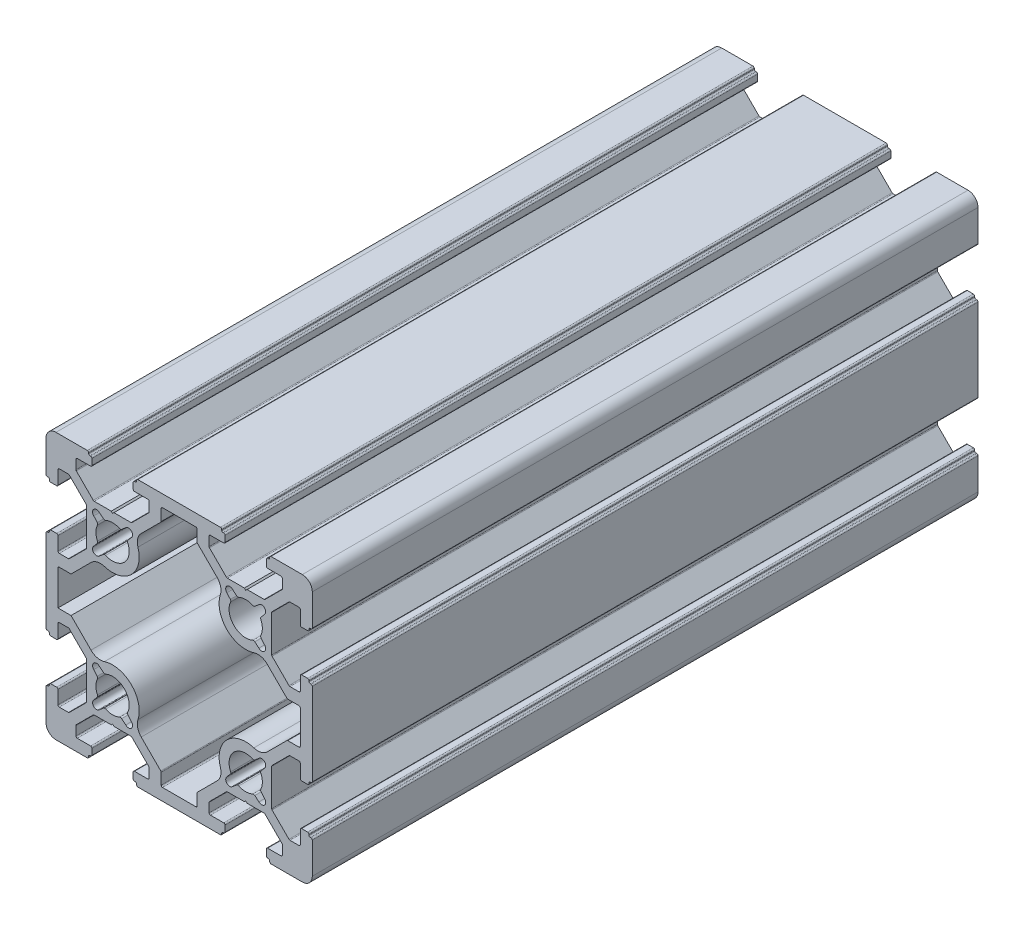
from build123d import *

# Parameters (mm, degrees)
EXTRUDE_1_DEPTH = 100


with BuildPart() as part:
    # 草图1 → 凸台-拉伸1 (new body)
    with BuildSketch(Plane.XY):
        with BuildLine():
            Line((42.461191718, 11.6), (43.361191718, 11.6))
            ThreePointArc((43.361191718, 11.6), (43.502613074, 11.658578644), (43.561191718, 11.8))
            Line((43.561191718, 11.8), (43.561191718, 11.9))
            ThreePointArc((43.561191718, 11.9), (43.619770361, 12.041421356), (43.761191718, 12.1))
            Line((43.761191718, 12.1), (43.861191718, 12.1))
            ThreePointArc((43.861191718, 12.1), (44.002613074, 12.158578644), (44.061191718, 12.3))
            Line((44.061191718, 12.3), (44.061191718, 24.7))
            ThreePointArc((44.061191718, 24.7), (44.002613074, 24.841421356), (43.861191718, 24.9))
            Line((43.861191718, 24.9), (43.761191718, 24.9))
            ThreePointArc((43.761191718, 24.9), (43.619770361, 24.958578644), (43.561191718, 25.1))
            Line((43.561191718, 25.1), (43.561191718, 25.2))
            ThreePointArc((43.561191718, 25.2), (43.502613074, 25.341421356), (43.361191718, 25.4))
            Line((43.361191718, 25.4), (42.461191718, 25.4))
            ThreePointArc((42.461191718, 25.4), (42.319770361, 25.341421356), (42.261191718, 25.2))
            Line((42.261191718, 25.2), (42.261191718, 23.2))
            ThreePointArc((42.261191718, 23.2), (42.202613074, 23.058578644), (42.061191718, 23))
            Line((42.061191718, 23), (40.704694602, 23))
            ThreePointArc((40.704694602, 23), (40.628157916, 23.015224093), (40.563273246, 23.058578644))
            Line((40.563273246, 23.058578644), (38.019770361, 25.602081528))
            ThreePointArc((38.019770361, 25.602081528), (37.976415811, 25.666966198), (37.961191718, 25.743502884))
            Line((37.961191718, 25.743502884), (37.961191718, 31.256497116))
            ThreePointArc((37.961191718, 31.256497116), (37.976415811, 31.333033802), (38.019770361, 31.397918472))
            Line((38.019770361, 31.397918472), (40.563273246, 33.941421356))
            ThreePointArc((40.563273246, 33.941421356), (40.628157916, 33.984775907), (40.704694602, 34))
            Line((40.704694602, 34), (42.061191718, 34))
            ThreePointArc((42.061191718, 34), (42.202613074, 33.941421356), (42.261191718, 33.8))
            Line((42.261191718, 33.8), (42.261191718, 31.8))
            ThreePointArc((42.261191718, 31.8), (42.319770361, 31.658578644), (42.461191718, 31.6))
            Line((42.461191718, 31.6), (43.361191718, 31.6))
            ThreePointArc((43.361191718, 31.6), (43.502613074, 31.658578644), (43.561191718, 31.8))
            Line((43.561191718, 31.8), (43.561191718, 31.9))
            ThreePointArc((43.561191718, 31.9), (43.619770361, 32.041421356), (43.761191718, 32.1))
            Line((43.761191718, 32.1), (43.861191718, 32.1))
            ThreePointArc((43.861191718, 32.1), (44.002613074, 32.158578644), (44.061191718, 32.3))
            Line((44.061191718, 32.3), (44.061191718, 37))
            ThreePointArc((44.061191718, 37), (43.62185189, 38.060660172), (42.561191718, 38.5))
            Line((42.561191718, 38.5), (37.861191718, 38.5))
            ThreePointArc((37.861191718, 38.5), (37.719770361, 38.441421356), (37.661191718, 38.3))
            Line((37.661191718, 38.3), (37.661191718, 38.2))
            ThreePointArc((37.661191718, 38.2), (37.602613074, 38.058578644), (37.461191718, 38))
            Line((37.461191718, 38), (37.361191718, 38))
            ThreePointArc((37.361191718, 38), (37.219770361, 37.941421356), (37.161191718, 37.8))
            Line((37.161191718, 37.8), (37.161191718, 36.9))
            ThreePointArc((37.161191718, 36.9), (37.219770361, 36.758578644), (37.361191718, 36.7))
            Line((37.361191718, 36.7), (39.361191718, 36.7))
            ThreePointArc((39.361191718, 36.7), (39.502613074, 36.641421356), (39.561191718, 36.5))
            Line((39.561191718, 36.5), (39.561191718, 35.143502884))
            ThreePointArc((39.561191718, 35.143502884), (39.545967624, 35.066966198), (39.502613074, 35.002081528))
            Line((39.502613074, 35.002081528), (36.95911019, 32.458578644))
            ThreePointArc((36.95911019, 32.458578644), (36.89422552, 32.415224093), (36.817688833, 32.4))
            Line((36.817688833, 32.4), (34.261191718, 32.4))
            Line((34.261191718, 32.4), (34.061191718, 32.2))
            Line((34.061191718, 32.2), (33.861191718, 32.4))
            Line((33.861191718, 32.4), (31.304694602, 32.4))
            ThreePointArc((31.304694602, 32.4), (31.228157916, 32.415224093), (31.163273246, 32.458578644))
            Line((31.163273246, 32.458578644), (28.619770361, 35.002081528))
            ThreePointArc((28.619770361, 35.002081528), (28.576415811, 35.066966198), (28.561191718, 35.143502884))
            Line((28.561191718, 35.143502884), (28.561191718, 36.5))
            ThreePointArc((28.561191718, 36.5), (28.619770361, 36.641421356), (28.761191718, 36.7))
            Line((28.761191718, 36.7), (30.761191718, 36.7))
            ThreePointArc((30.761191718, 36.7), (30.902613074, 36.758578644), (30.961191718, 36.9))
            Line((30.961191718, 36.9), (30.961191718, 37.8))
            ThreePointArc((30.961191718, 37.8), (30.902613074, 37.941421356), (30.761191718, 38))
            Line((30.761191718, 38), (30.661191718, 38))
            ThreePointArc((30.661191718, 38), (30.519770361, 38.058578644), (30.461191718, 38.2))
            Line((30.461191718, 38.2), (30.461191718, 38.3))
            ThreePointArc((30.461191718, 38.3), (30.402613074, 38.441421356), (30.261191718, 38.5))
            Line((30.261191718, 38.5), (17.861191718, 38.5))
            ThreePointArc((17.861191718, 38.5), (17.719770361, 38.441421356), (17.661191718, 38.3))
            Line((17.661191718, 38.3), (17.661191718, 38.2))
            ThreePointArc((17.661191718, 38.2), (17.602613074, 38.058578644), (17.461191718, 38))
            Line((17.461191718, 38), (17.361191718, 38))
            ThreePointArc((17.361191718, 38), (17.219770361, 37.941421356), (17.161191718, 37.8))
            Line((17.161191718, 37.8), (17.161191718, 36.9))
            ThreePointArc((17.161191718, 36.9), (17.219770361, 36.758578644), (17.361191718, 36.7))
            Line((17.361191718, 36.7), (19.361191718, 36.7))
            ThreePointArc((19.361191718, 36.7), (19.502613074, 36.641421356), (19.561191718, 36.5))
            Line((19.561191718, 36.5), (19.561191718, 35.143502884))
            ThreePointArc((19.561191718, 35.143502884), (19.545967624, 35.066966198), (19.502613074, 35.002081528))
            Line((19.502613074, 35.002081528), (16.95911019, 32.458578644))
            ThreePointArc((16.95911019, 32.458578644), (16.89422552, 32.415224093), (16.817688833, 32.4))
            Line((16.817688833, 32.4), (14.261191718, 32.4))
            Line((14.261191718, 32.4), (14.061191718, 32.2))
            Line((14.061191718, 32.2), (13.861191718, 32.4))
            Line((13.861191718, 32.4), (11.304694602, 32.4))
            ThreePointArc((11.304694602, 32.4), (11.228157916, 32.415224093), (11.163273246, 32.458578644))
            Line((11.163273246, 32.458578644), (8.619770361, 35.002081528))
            ThreePointArc((8.619770361, 35.002081528), (8.576415811, 35.066966198), (8.561191718, 35.143502884))
            Line((8.561191718, 35.143502884), (8.561191718, 36.5))
            ThreePointArc((8.561191718, 36.5), (8.619770361, 36.641421356), (8.761191718, 36.7))
            Line((8.761191718, 36.7), (10.761191718, 36.7))
            ThreePointArc((10.761191718, 36.7), (10.902613074, 36.758578644), (10.961191718, 36.9))
            Line((10.961191718, 36.9), (10.961191718, 37.8))
            ThreePointArc((10.961191718, 37.8), (10.902613074, 37.941421356), (10.761191718, 38))
            Line((10.761191718, 38), (10.661191718, 38))
            ThreePointArc((10.661191718, 38), (10.519770361, 38.058578644), (10.461191718, 38.2))
            Line((10.461191718, 38.2), (10.461191718, 38.3))
            ThreePointArc((10.461191718, 38.3), (10.402613074, 38.441421356), (10.261191718, 38.5))
            Line((10.261191718, 38.5), (5.561191718, 38.5))
            ThreePointArc((5.561191718, 38.5), (4.500531546, 38.060660172), (4.061191718, 37))
            Line((4.061191718, 37), (4.061191718, 32.3))
            ThreePointArc((4.061191718, 32.3), (4.119770361, 32.158578644), (4.261191718, 32.1))
            Line((4.261191718, 32.1), (4.361191718, 32.1))
            ThreePointArc((4.361191718, 32.1), (4.502613074, 32.041421356), (4.561191718, 31.9))
            Line((4.561191718, 31.9), (4.561191718, 31.8))
            ThreePointArc((4.561191718, 31.8), (4.619770361, 31.658578644), (4.761191718, 31.6))
            Line((4.761191718, 31.6), (5.661191718, 31.6))
            ThreePointArc((5.661191718, 31.6), (5.802613074, 31.658578644), (5.861191718, 31.8))
            Line((5.861191718, 31.8), (5.861191718, 33.8))
            ThreePointArc((5.861191718, 33.8), (5.919770361, 33.941421356), (6.061191718, 34))
            Line((6.061191718, 34), (7.417688833, 34))
            ThreePointArc((7.417688833, 34), (7.49422552, 33.984775907), (7.55911019, 33.941421356))
            Line((7.55911019, 33.941421356), (10.102613074, 31.397918472))
            ThreePointArc((10.102613074, 31.397918472), (10.145967624, 31.333033802), (10.161191718, 31.256497116))
            Line((10.161191718, 31.256497116), (10.161191718, 25.743502884))
            ThreePointArc((10.161191718, 25.743502884), (10.145967624, 25.666966198), (10.102613074, 25.602081528))
            Line((10.102613074, 25.602081528), (7.55911019, 23.058578644))
            ThreePointArc((7.55911019, 23.058578644), (7.49422552, 23.015224093), (7.417688833, 23))
            Line((7.417688833, 23), (6.061191718, 23))
            ThreePointArc((6.061191718, 23), (5.919770361, 23.058578644), (5.861191718, 23.2))
            Line((5.861191718, 23.2), (5.861191718, 25.2))
            ThreePointArc((5.861191718, 25.2), (5.802613074, 25.341421356), (5.661191718, 25.4))
            Line((5.661191718, 25.4), (4.761191718, 25.4))
            ThreePointArc((4.761191718, 25.4), (4.619770361, 25.341421356), (4.561191718, 25.2))
            Line((4.561191718, 25.2), (4.561191718, 25.1))
            ThreePointArc((4.561191718, 25.1), (4.502613074, 24.958578644), (4.361191718, 24.9))
            Line((4.361191718, 24.9), (4.261191718, 24.9))
            ThreePointArc((4.261191718, 24.9), (4.119770361, 24.841421356), (4.061191718, 24.7))
            Line((4.061191718, 24.7), (4.061191718, 12.3))
            ThreePointArc((4.061191718, 12.3), (4.119770361, 12.158578644), (4.261191718, 12.1))
            Line((4.261191718, 12.1), (4.361191718, 12.1))
            ThreePointArc((4.361191718, 12.1), (4.502613074, 12.041421356), (4.561191718, 11.9))
            Line((4.561191718, 11.9), (4.561191718, 11.8))
            ThreePointArc((4.561191718, 11.8), (4.619770361, 11.658578644), (4.761191718, 11.6))
            Line((4.761191718, 11.6), (5.661191718, 11.6))
            ThreePointArc((5.661191718, 11.6), (5.802613074, 11.658578644), (5.861191718, 11.8))
            Line((5.861191718, 11.8), (5.861191718, 13.8))
            ThreePointArc((5.861191718, 13.8), (5.919770361, 13.941421356), (6.061191718, 14))
            Line((6.061191718, 14), (7.417688833, 14))
            ThreePointArc((7.417688833, 14), (7.49422552, 13.984775907), (7.55911019, 13.941421356))
            Line((7.55911019, 13.941421356), (10.102613074, 11.397918472))
            ThreePointArc((10.102613074, 11.397918472), (10.145967624, 11.333033802), (10.161191718, 11.256497116))
            Line((10.161191718, 11.256497116), (10.161191718, 5.743502884))
            ThreePointArc((10.161191718, 5.743502884), (10.145967624, 5.666966198), (10.102613074, 5.602081528))
            Line((10.102613074, 5.602081528), (7.55911019, 3.058578644))
            ThreePointArc((7.55911019, 3.058578644), (7.49422552, 3.015224093), (7.417688833, 3))
            Line((7.417688833, 3), (6.061191718, 3))
            ThreePointArc((6.061191718, 3), (5.919770361, 3.058578644), (5.861191718, 3.2))
            Line((5.861191718, 3.2), (5.861191718, 5.2))
            ThreePointArc((5.861191718, 5.2), (5.802613074, 5.341421356), (5.661191718, 5.4))
            Line((5.661191718, 5.4), (4.761191718, 5.4))
            ThreePointArc((4.761191718, 5.4), (4.619770361, 5.341421356), (4.561191718, 5.2))
            Line((4.561191718, 5.2), (4.561191718, 5.1))
            ThreePointArc((4.561191718, 5.1), (4.502613074, 4.958578644), (4.361191718, 4.9))
            Line((4.361191718, 4.9), (4.261191718, 4.9))
            ThreePointArc((4.261191718, 4.9), (4.119770361, 4.841421356), (4.061191718, 4.7))
            Line((4.061191718, 4.7), (4.061191718, 0))
            ThreePointArc((4.061191718, 0), (4.500531546, -1.060660172), (5.561191718, -1.5))
            Line((5.561191718, -1.5), (10.261191718, -1.5))
            ThreePointArc((10.261191718, -1.5), (10.402613074, -1.441421356), (10.461191718, -1.3))
            Line((10.461191718, -1.3), (10.461191718, -1.2))
            ThreePointArc((10.461191718, -1.2), (10.519770361, -1.058578644), (10.661191718, -1))
            Line((10.661191718, -1), (10.761191718, -1))
            ThreePointArc((10.761191718, -1), (10.902613074, -0.941421356), (10.961191718, -0.8))
            Line((10.961191718, -0.8), (10.961191718, 0.1))
            ThreePointArc((10.961191718, 0.1), (10.902613074, 0.241421356), (10.761191718, 0.3))
            Line((10.761191718, 0.3), (8.761191718, 0.3))
            ThreePointArc((8.761191718, 0.3), (8.619770361, 0.358578644), (8.561191718, 0.5))
            Line((8.561191718, 0.5), (8.561191718, 1.856497116))
            ThreePointArc((8.561191718, 1.856497116), (8.576415811, 1.933033802), (8.619770361, 1.997918472))
            Line((8.619770361, 1.997918472), (11.163273246, 4.541421356))
            ThreePointArc((11.163273246, 4.541421356), (11.228157916, 4.584775907), (11.304694602, 4.6))
            Line((11.304694602, 4.6), (13.861191718, 4.6))
            Line((13.861191718, 4.6), (14.061191718, 4.8))
            Line((14.061191718, 4.8), (14.261191718, 4.6))
            Line((14.261191718, 4.6), (16.817688833, 4.6))
            ThreePointArc((16.817688833, 4.6), (16.89422552, 4.584775907), (16.95911019, 4.541421356))
            Line((16.95911019, 4.541421356), (19.502613074, 1.997918472))
            ThreePointArc((19.502613074, 1.997918472), (19.545967624, 1.933033802), (19.561191718, 1.856497116))
            Line((19.561191718, 1.856497116), (19.561191718, 0.5))
            ThreePointArc((19.561191718, 0.5), (19.502613074, 0.358578644), (19.361191718, 0.3))
            Line((19.361191718, 0.3), (17.361191718, 0.3))
            ThreePointArc((17.361191718, 0.3), (17.219770361, 0.241421356), (17.161191718, 0.1))
            Line((17.161191718, 0.1), (17.161191718, -0.8))
            ThreePointArc((17.161191718, -0.8), (17.219770361, -0.941421356), (17.361191718, -1))
            Line((17.361191718, -1), (17.461191718, -1))
            ThreePointArc((17.461191718, -1), (17.602613074, -1.058578644), (17.661191718, -1.2))
            Line((17.661191718, -1.2), (17.661191718, -1.3))
            ThreePointArc((17.661191718, -1.3), (17.719770361, -1.441421356), (17.861191718, -1.5))
            Line((17.861191718, -1.5), (30.261191718, -1.5))
            ThreePointArc((30.261191718, -1.5), (30.402613074, -1.441421356), (30.461191718, -1.3))
            Line((30.461191718, -1.3), (30.461191718, -1.2))
            ThreePointArc((30.461191718, -1.2), (30.519770361, -1.058578644), (30.661191718, -1))
            Line((30.661191718, -1), (30.761191718, -1))
            ThreePointArc((30.761191718, -1), (30.902613074, -0.941421356), (30.961191718, -0.8))
            Line((30.961191718, -0.8), (30.961191718, 0.1))
            ThreePointArc((30.961191718, 0.1), (30.902613074, 0.241421356), (30.761191718, 0.3))
            Line((30.761191718, 0.3), (28.761191718, 0.3))
            ThreePointArc((28.761191718, 0.3), (28.619770361, 0.358578644), (28.561191718, 0.5))
            Line((28.561191718, 0.5), (28.561191718, 1.856497116))
            ThreePointArc((28.561191718, 1.856497116), (28.576415811, 1.933033802), (28.619770361, 1.997918472))
            Line((28.619770361, 1.997918472), (31.163273246, 4.541421356))
            ThreePointArc((31.163273246, 4.541421356), (31.228157916, 4.584775907), (31.304694602, 4.6))
            Line((31.304694602, 4.6), (33.861191718, 4.6))
            Line((33.861191718, 4.6), (34.061191718, 4.8))
            Line((34.061191718, 4.8), (34.261191718, 4.6))
            Line((34.261191718, 4.6), (36.817688833, 4.6))
            ThreePointArc((36.817688833, 4.6), (36.89422552, 4.584775907), (36.95911019, 4.541421356))
            Line((36.95911019, 4.541421356), (39.502613074, 1.997918472))
            ThreePointArc((39.502613074, 1.997918472), (39.545967624, 1.933033802), (39.561191718, 1.856497116))
            Line((39.561191718, 1.856497116), (39.561191718, 0.5))
            ThreePointArc((39.561191718, 0.5), (39.502613074, 0.358578644), (39.361191718, 0.3))
            Line((39.361191718, 0.3), (37.361191718, 0.3))
            ThreePointArc((37.361191718, 0.3), (37.219770361, 0.241421356), (37.161191718, 0.1))
            Line((37.161191718, 0.1), (37.161191718, -0.8))
            ThreePointArc((37.161191718, -0.8), (37.219770361, -0.941421356), (37.361191718, -1))
            Line((37.361191718, -1), (37.461191718, -1))
            ThreePointArc((37.461191718, -1), (37.602613074, -1.058578644), (37.661191718, -1.2))
            Line((37.661191718, -1.2), (37.661191718, -1.3))
            ThreePointArc((37.661191718, -1.3), (37.719770361, -1.441421356), (37.861191718, -1.5))
            Line((37.861191718, -1.5), (42.561191718, -1.5))
            ThreePointArc((42.561191718, -1.5), (43.62185189, -1.060660172), (44.061191718, 0))
            Line((44.061191718, 0), (44.061191718, 4.7))
            ThreePointArc((44.061191718, 4.7), (44.002613074, 4.841421356), (43.861191718, 4.9))
            Line((43.861191718, 4.9), (43.761191718, 4.9))
            ThreePointArc((43.761191718, 4.9), (43.619770361, 4.958578644), (43.561191718, 5.1))
            Line((43.561191718, 5.1), (43.561191718, 5.2))
            ThreePointArc((43.561191718, 5.2), (43.502613074, 5.341421356), (43.361191718, 5.4))
            Line((43.361191718, 5.4), (42.461191718, 5.4))
            ThreePointArc((42.461191718, 5.4), (42.319770361, 5.341421356), (42.261191718, 5.2))
            Line((42.261191718, 5.2), (42.261191718, 3.2))
            ThreePointArc((42.261191718, 3.2), (42.202613074, 3.058578644), (42.061191718, 3))
            Line((42.061191718, 3), (40.704694602, 3))
            ThreePointArc((40.704694602, 3), (40.628157916, 3.015224093), (40.563273246, 3.058578644))
            Line((40.563273246, 3.058578644), (38.019770361, 5.602081528))
            ThreePointArc((38.019770361, 5.602081528), (37.976415811, 5.666966198), (37.961191718, 5.743502884))
            Line((37.961191718, 5.743502884), (37.961191718, 11.256497116))
            ThreePointArc((37.961191718, 11.256497116), (37.976415811, 11.333033802), (38.019770361, 11.397918472))
            Line((38.019770361, 11.397918472), (40.563273246, 13.941421356))
            ThreePointArc((40.563273246, 13.941421356), (40.628157916, 13.984775907), (40.704694602, 14))
            Line((40.704694602, 14), (42.061191718, 14))
            ThreePointArc((42.061191718, 14), (42.202613074, 13.941421356), (42.261191718, 13.8))
            Line((42.261191718, 13.8), (42.261191718, 11.8))
            ThreePointArc((42.261191718, 11.8), (42.319770361, 11.658578644), (42.461191718, 11.6))
        make_face()
        with BuildLine():
            Line((31.7483644, 7.134568935), (31.232764593, 6.520101013))
            ThreePointArc((31.232764593, 6.520101013), (31.232764593, 5.671572875), (32.08129273, 5.671572875))
            Line((32.08129273, 5.671572875), (32.695760653, 6.187172682))
            ThreePointArc((32.695760653, 6.187172682), (32.848810592, 6.25470939), (33.014232091, 6.229785133))
            ThreePointArc((33.014232091, 6.229785133), (34.061191718, 6), (35.108151344, 6.229785133))
            ThreePointArc((35.108151344, 6.229785133), (35.273572843, 6.25470939), (35.426622782, 6.187172682))
            Line((35.426622782, 6.187172682), (36.041090705, 5.671572875))
            ThreePointArc((36.041090705, 5.671572875), (36.889618842, 5.671572875), (36.889618842, 6.520101013))
            Line((36.889618842, 6.520101013), (36.374019035, 7.134568935))
            ThreePointArc((36.374019035, 7.134568935), (36.306482327, 7.287618875), (36.331406584, 7.453040373))
            ThreePointArc((36.331406584, 7.453040373), (36.561191718, 8.5), (36.331406584, 9.546959627))
            ThreePointArc((36.331406584, 9.546959627), (36.306482327, 9.712381125), (36.374019035, 9.865431065))
            Line((36.374019035, 9.865431065), (36.889618842, 10.479898987))
            ThreePointArc((36.889618842, 10.479898987), (36.889618842, 11.328427125), (36.041090705, 11.328427125))
            Line((36.041090705, 11.328427125), (35.426622782, 10.812827318))
            ThreePointArc((35.426622782, 10.812827318), (35.273572843, 10.74529061), (35.108151344, 10.770214867))
            ThreePointArc((35.108151344, 10.770214867), (32.293424765, 10.267766953), (31.790976851, 7.453040373))
            ThreePointArc((31.790976851, 7.453040373), (31.815901108, 7.287618875), (31.7483644, 7.134568935))
        make_face(mode=Mode.SUBTRACT)
        with BuildLine():
            Line((35.426622782, 26.187172682), (36.041090705, 25.671572875))
            ThreePointArc((36.041090705, 25.671572875), (36.889618842, 25.671572875), (36.889618842, 26.520101013))
            Line((36.889618842, 26.520101013), (36.374019035, 27.134568935))
            ThreePointArc((36.374019035, 27.134568935), (36.306482327, 27.287618875), (36.331406584, 27.453040373))
            ThreePointArc((36.331406584, 27.453040373), (36.561191718, 28.5), (36.331406584, 29.546959627))
            ThreePointArc((36.331406584, 29.546959627), (36.306482327, 29.712381125), (36.374019035, 29.865431065))
            Line((36.374019035, 29.865431065), (36.889618842, 30.479898987))
            ThreePointArc((36.889618842, 30.479898987), (36.889618842, 31.328427125), (36.041090705, 31.328427125))
            Line((36.041090705, 31.328427125), (35.426622782, 30.812827318))
            ThreePointArc((35.426622782, 30.812827318), (35.273572843, 30.74529061), (35.108151344, 30.770214867))
            ThreePointArc((35.108151344, 30.770214867), (34.061191718, 31), (33.014232091, 30.770214867))
            ThreePointArc((33.014232091, 30.770214867), (32.848810592, 30.74529061), (32.695760653, 30.812827318))
            Line((32.695760653, 30.812827318), (32.08129273, 31.328427125))
            ThreePointArc((32.08129273, 31.328427125), (31.232764593, 31.328427125), (31.232764593, 30.479898987))
            Line((31.232764593, 30.479898987), (31.7483644, 29.865431065))
            ThreePointArc((31.7483644, 29.865431065), (31.815901108, 29.712381125), (31.790976851, 29.546959627))
            ThreePointArc((31.790976851, 29.546959627), (32.293424765, 26.732233047), (35.108151344, 26.229785133))
            ThreePointArc((35.108151344, 26.229785133), (35.273572843, 26.25470939), (35.426622782, 26.187172682))
        make_face(mode=Mode.SUBTRACT)
        with BuildLine():
            Line((42.261191718, 16), (42.261191718, 21))
            ThreePointArc((42.261191718, 21), (42.202613074, 21.141421356), (42.061191718, 21.2))
            Line((42.061191718, 21.2), (40.383374258, 21.2))
            ThreePointArc((40.383374258, 21.2), (40.306837572, 21.215224093), (40.241952902, 21.258578644))
            Line((40.241952902, 21.258578644), (37.301637414, 24.198894132))
            ThreePointArc((37.301637414, 24.198894132), (36.359058508, 24.728275371), (35.278679807, 24.689787046))
            ThreePointArc((35.278679807, 24.689787046), (31.232764593, 25.671572875), (30.250978764, 29.717488089))
            ThreePointArc((30.250978764, 29.717488089), (30.289467088, 30.797866791), (29.76008585, 31.740445696))
            Line((29.76008585, 31.740445696), (26.819770361, 34.680761184))
            ThreePointArc((26.819770361, 34.680761184), (26.776415811, 34.745645854), (26.761191718, 34.822182541))
            Line((26.761191718, 34.822182541), (26.761191718, 36.5))
            ThreePointArc((26.761191718, 36.5), (26.702613074, 36.641421356), (26.561191718, 36.7))
            Line((26.561191718, 36.7), (21.561191718, 36.7))
            ThreePointArc((21.561191718, 36.7), (21.419770361, 36.641421356), (21.361191718, 36.5))
            Line((21.361191718, 36.5), (21.361191718, 34.822182541))
            ThreePointArc((21.361191718, 34.822182541), (21.345967624, 34.745645854), (21.302613074, 34.680761184))
            Line((21.302613074, 34.680761184), (18.362297586, 31.740445696))
            ThreePointArc((18.362297586, 31.740445696), (17.832916347, 30.797866791), (17.871404671, 29.717488089))
            ThreePointArc((17.871404671, 29.717488089), (16.889618842, 25.671572875), (12.843703628, 24.689787046))
            ThreePointArc((12.843703628, 24.689787046), (11.763324927, 24.728275371), (10.820746021, 24.198894132))
            Line((10.820746021, 24.198894132), (7.880430533, 21.258578644))
            ThreePointArc((7.880430533, 21.258578644), (7.815545863, 21.215224093), (7.739009177, 21.2))
            Line((7.739009177, 21.2), (6.061191718, 21.2))
            ThreePointArc((6.061191718, 21.2), (5.919770361, 21.141421356), (5.861191718, 21))
            Line((5.861191718, 21), (5.861191718, 15.8))
            Line((5.861191718, 15.8), (7.82185189, 15.8))
            Line((7.82185189, 15.8), (10.820746021, 12.801105868))
            ThreePointArc((10.820746021, 12.801105868), (11.763324927, 12.271724629), (12.843703628, 12.310212954))
            ThreePointArc((12.843703628, 12.310212954), (16.889618842, 11.328427125), (17.871404671, 7.282511911))
            ThreePointArc((17.871404671, 7.282511911), (17.832916347, 6.202133209), (18.362297586, 5.259554304))
            Line((18.362297586, 5.259554304), (21.302613074, 2.319238816))
            ThreePointArc((21.302613074, 2.319238816), (21.345967624, 2.254354146), (21.361191718, 2.177817459))
            Line((21.361191718, 2.177817459), (21.361191718, 0.5))
            ThreePointArc((21.361191718, 0.5), (21.419770361, 0.358578644), (21.561191718, 0.3))
            Line((21.561191718, 0.3), (26.561191718, 0.3))
            ThreePointArc((26.561191718, 0.3), (26.702613074, 0.358578644), (26.761191718, 0.5))
            Line((26.761191718, 0.5), (26.761191718, 2.177817459))
            ThreePointArc((26.761191718, 2.177817459), (26.776415811, 2.254354146), (26.819770361, 2.319238816))
            Line((26.819770361, 2.319238816), (29.76008585, 5.259554304))
            ThreePointArc((29.76008585, 5.259554304), (30.289467088, 6.202133209), (30.250978764, 7.282511911))
            ThreePointArc((30.250978764, 7.282511911), (31.232764593, 11.328427125), (35.278679807, 12.310212954))
            ThreePointArc((35.278679807, 12.310212954), (36.359058508, 12.271724629), (37.301637414, 12.801105868))
            Line((37.301637414, 12.801105868), (40.241952902, 15.741421356))
            ThreePointArc((40.241952902, 15.741421356), (40.306837572, 15.784775907), (40.383374258, 15.8))
            Line((40.383374258, 15.8), (42.061191718, 15.8))
            ThreePointArc((42.061191718, 15.8), (42.202613074, 15.858578644), (42.261191718, 16))
        make_face(mode=Mode.SUBTRACT)
        with BuildLine():
            Line((12.695760653, 10.812827318), (12.08129273, 11.328427125))
            ThreePointArc((12.08129273, 11.328427125), (11.232764593, 11.328427125), (11.232764593, 10.479898987))
            Line((11.232764593, 10.479898987), (11.7483644, 9.865431065))
            ThreePointArc((11.7483644, 9.865431065), (11.815901108, 9.712381125), (11.790976851, 9.546959627))
            ThreePointArc((11.790976851, 9.546959627), (11.561191718, 8.5), (11.790976851, 7.453040373))
            ThreePointArc((11.790976851, 7.453040373), (11.815901108, 7.287618875), (11.7483644, 7.134568935))
            Line((11.7483644, 7.134568935), (11.232764593, 6.520101013))
            ThreePointArc((11.232764593, 6.520101013), (11.232764593, 5.671572875), (12.08129273, 5.671572875))
            Line((12.08129273, 5.671572875), (12.695760653, 6.187172682))
            ThreePointArc((12.695760653, 6.187172682), (12.848810592, 6.25470939), (13.014232091, 6.229785133))
            ThreePointArc((13.014232091, 6.229785133), (14.061191718, 6), (15.108151344, 6.229785133))
            ThreePointArc((15.108151344, 6.229785133), (15.273572843, 6.25470939), (15.426622782, 6.187172682))
            Line((15.426622782, 6.187172682), (16.041090705, 5.671572875))
            ThreePointArc((16.041090705, 5.671572875), (16.889618842, 5.671572875), (16.889618842, 6.520101013))
            Line((16.889618842, 6.520101013), (16.374019035, 7.134568935))
            ThreePointArc((16.374019035, 7.134568935), (16.306482327, 7.287618875), (16.331406584, 7.453040373))
            ThreePointArc((16.331406584, 7.453040373), (15.828958671, 10.267766953), (13.014232091, 10.770214867))
            ThreePointArc((13.014232091, 10.770214867), (12.848810592, 10.74529061), (12.695760653, 10.812827318))
        make_face(mode=Mode.SUBTRACT)
        with BuildLine():
            Line((16.374019035, 29.865431065), (16.889618842, 30.479898987))
            ThreePointArc((16.889618842, 30.479898987), (16.889618842, 31.328427125), (16.041090705, 31.328427125))
            Line((16.041090705, 31.328427125), (15.426622782, 30.812827318))
            ThreePointArc((15.426622782, 30.812827318), (15.273572843, 30.74529061), (15.108151344, 30.770214867))
            ThreePointArc((15.108151344, 30.770214867), (14.061191718, 31), (13.014232091, 30.770214867))
            ThreePointArc((13.014232091, 30.770214867), (12.848810592, 30.74529061), (12.695760653, 30.812827318))
            Line((12.695760653, 30.812827318), (12.08129273, 31.328427125))
            ThreePointArc((12.08129273, 31.328427125), (11.232764593, 31.328427125), (11.232764593, 30.479898987))
            Line((11.232764593, 30.479898987), (11.7483644, 29.865431065))
            ThreePointArc((11.7483644, 29.865431065), (11.815901108, 29.712381125), (11.790976851, 29.546959627))
            ThreePointArc((11.790976851, 29.546959627), (11.561191718, 28.5), (11.790976851, 27.453040373))
            ThreePointArc((11.790976851, 27.453040373), (11.815901108, 27.287618875), (11.7483644, 27.134568935))
            Line((11.7483644, 27.134568935), (11.232764593, 26.520101013))
            ThreePointArc((11.232764593, 26.520101013), (11.232764593, 25.671572875), (12.08129273, 25.671572875))
            Line((12.08129273, 25.671572875), (12.695760653, 26.187172682))
            ThreePointArc((12.695760653, 26.187172682), (12.848810592, 26.25470939), (13.014232091, 26.229785133))
            ThreePointArc((13.014232091, 26.229785133), (15.828958671, 26.732233047), (16.331406584, 29.546959627))
            ThreePointArc((16.331406584, 29.546959627), (16.306482327, 29.712381125), (16.374019035, 29.865431065))
        make_face(mode=Mode.SUBTRACT)
    extrude(amount=EXTRUDE_1_DEPTH)


solid = part.part
